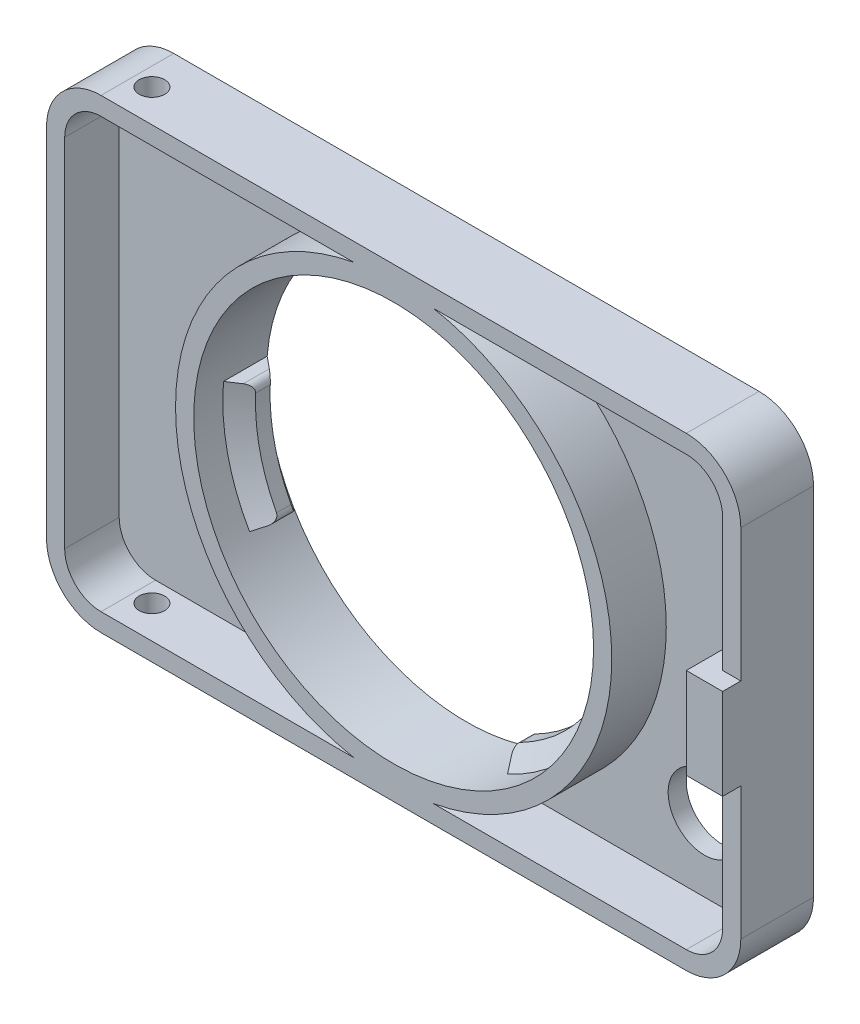
from build123d import *

# Parameters (mm, degrees)
BOSS_EXTRUDE1_DEPTH      = 20
SKETCH2_R                = 55
CUT_EXTRUDE1_DEPTH       = 117.688688398
SHELL1_T                 = -5
FILLET1_R                = 2
CIRPATTERN1_COUNT        = 3
FILLET1_OF_CIRPATTERN1_R = 2
SKETCH5_R                = 10
CUT_EXTRUDE2_DEPTH       = 117.688688398
CUT_EXTRUDE3_DEPTH       = 117.688688398
CUT_EXTRUDE3_DEPTH_BACK  = 117.688688398
SKETCH6_R                = 3.5
SKETCH7_W                = 10
SKETCH7_H                = 25
BOSS_EXTRUDE2_DEPTH      = 20


with BuildPart() as part:
    # Sketch1 → Boss-Extrude1 (new body)
    with BuildSketch(Plane.XY):
        with BuildLine():
            Line((-80.5, 64), (80.5, 64))
            ThreePointArc((80.5, 64), (91.106601718, 59.606601718), (95.5, 49))
            Line((95.5, 49), (95.5, -49))
            ThreePointArc((95.5, -49), (91.106601718, -59.606601718), (80.5, -64))
            Line((80.5, -64), (-80.5, -64))
            ThreePointArc((-80.5, -64), (-91.106601718, -59.606601718), (-95.5, -49))
            Line((-95.5, -49), (-95.5, 49))
            ThreePointArc((-95.5, 49), (-91.106601718, 59.606601718), (-80.5, 64))
        make_face()
    extrude(amount=BOSS_EXTRUDE1_DEPTH)

    # Sketch2 → Cut-Extrude1 (cut, through all)
    with BuildSketch(Plane.XY.offset(20)):
        Circle(SKETCH2_R)
    extrude(amount=-CUT_EXTRUDE1_DEPTH, mode=Mode.SUBTRACT)

    # Shell1
    shell1_openings = [part.faces().sort_by_distance(p)[0] for p in [
        (0, 61.700760995, 20),
    ]]
    offset(amount=SHELL1_T, openings=shell1_openings)

    # Sweep1: sweep along a path in Sketch4
    with BuildLine(Plane.XY) as sweep1_path:
        ThreePointArc((0, 50), (15, 47.696960071), (28.618176043, 41))
    # Sketch3 → Sweep1 (sweep)
    with BuildSketch(Plane(origin=(0, 0, 0), x_dir=(0, 0, -1), z_dir=(1, 0, 0))):
        Polygon((0, 55), (-12, 55), (-8, 50), (-4, 50), align=None)
    sweep1 = sweep(path=sweep1_path.line)

    # Fillet1
    fillet1_edges = [part.edges().sort_by_distance(p)[0] for p in [
        (28.618176043, 41, 6),
        (0, 50, 6),
    ]]
    fillet(fillet1_edges, radius=FILLET1_R)

    # CirPattern1: Sweep1 ×3 about axis
    cirpattern1_axis = Axis((0, 0, 0), (0, 0, 1))
    for i in range(1, CIRPATTERN1_COUNT):
        add(sweep1.rotate(cirpattern1_axis, i * 360 / CIRPATTERN1_COUNT))

    # Fillet1 of CirPattern1
    fillet1_of_cirpattern1_edges = [part.edges().sort_by_distance(p)[0] for p in [
        (-49.816129576, 4.284067463, 6),
        (-43.301270189, -25, 6),
        (21.197953534, -45.284067463, 6),
        (43.301270189, -25, 6),
    ]]
    fillet(fillet1_of_cirpattern1_edges, radius=FILLET1_OF_CIRPATTERN1_R)

    # Sketch5 → Cut-Extrude2 (cut, through all)
    with BuildSketch(Plane(origin=(0, 0, 0), x_dir=(-1, 0, 0), z_dir=(0, 0, -1))):
        with Locations((-70.5, -39)):
            Circle(SKETCH5_R)
    extrude(amount=-CUT_EXTRUDE2_DEPTH, mode=Mode.SUBTRACT)

    # Sketch6 → Cut-Extrude3 (cut, two sides: drawn at the far end of the back side and taken through both)
    with BuildSketch(Plane(origin=(0, 0, 0), x_dir=(1, 0, 0), z_dir=(0, 1, 0)).offset(-CUT_EXTRUDE3_DEPTH_BACK)):
        with Locations(Location((-75.5, -11, 0), (0, 0, 270))):
            Circle(SKETCH6_R)
    extrude(amount=CUT_EXTRUDE3_DEPTH + CUT_EXTRUDE3_DEPTH_BACK, mode=Mode.SUBTRACT)

    # Sketch7 → Boss-Extrude2 (add)
    with BuildSketch(Plane.XY.offset(5)):
        with Locations((90.5, 0)):
            Rectangle(SKETCH7_W, SKETCH7_H)
    extrude(amount=BOSS_EXTRUDE2_DEPTH)


solid = part.part
